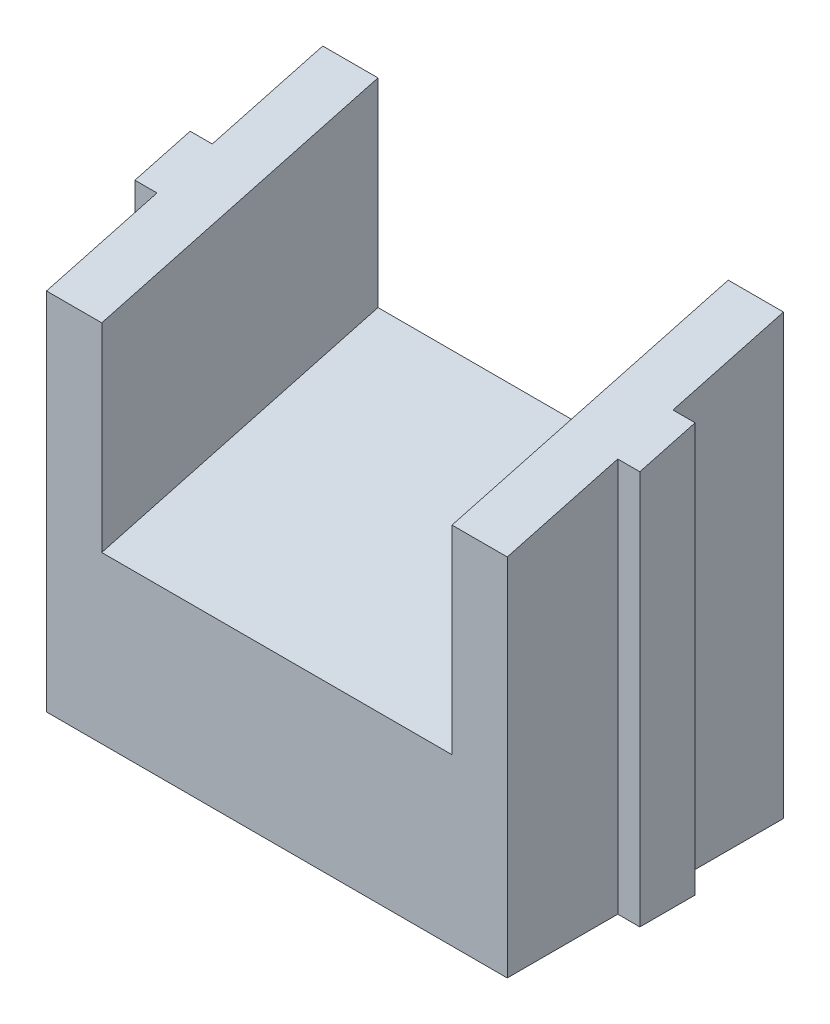
from build123d import *

# Parameters (mm, degrees)
SKETCH_1_W      = 2
SKETCH_1_H      = 5
SKETCH_1_W_2    = 41.7
SKETCH_1_H_2    = 25
EXTRUDE_1_DEPTH = 15
EXTRUDE_2_DEPTH = 41.7
SKETCH_4_W      = 5
SKETCH_4_H      = 25.88190451
EXTRUDE_4_DEPTH = 18
EXTRUDE_3_REACH = 58.078
SKETCH_3_W      = 2
SKETCH_3_H      = 5


with BuildPart() as part:
    # 草圖1 → 填料-伸長1 (new body)
    with BuildSketch(Plane(origin=(0, 0, 0), x_dir=(1, 0, 0), z_dir=(0, 1, 0))):
        with Locations((-1, 12.5)):
            Rectangle(SKETCH_1_W, SKETCH_1_H)
        with Locations((20.85, 12.5)):
            Rectangle(SKETCH_1_W_2, SKETCH_1_H_2)
        with Locations((42.7, 12.5)):
            Rectangle(SKETCH_1_W, SKETCH_1_H)
    extrude(amount=EXTRUDE_1_DEPTH)

    # 草圖2 → 填料-伸長2 (add)
    with BuildSketch(Plane(origin=(41.7, 0, 0), x_dir=(0, 0, -1), z_dir=(1, 0, 0))):
        Polygon((0, 15), (25, 21.698729811), (25, 15), align=None)
    extrude(amount=-EXTRUDE_2_DEPTH)

    # 草圖4 → 填料-伸長4 (add, along a direction that is not the sketch's normal)
    with BuildSketch(Plane(origin=(0, 13.995190528, 3.75), x_dir=(1, 0, 0), z_dir=(0, 0.9659258262890681, 0.25881904510252157))):
        with Locations((2.5, 16.823237932)):
            Rectangle(SKETCH_4_W, SKETCH_4_H)
        with Locations((39.2, 16.823237932)):
            Rectangle(SKETCH_4_W, SKETCH_4_H)
    extrude(amount=EXTRUDE_4_DEPTH, dir=(0, 1, 0))

    # 填料-伸長3: up to this plane
    extrude_3_end = Plane(origin=(0, 31.995190528, 3.75), z_dir=(0, 0.9659258262890682, 0.2588190451025215))
    # 草圖3 → 填料-伸長3 (add, up to the surface)
    with BuildSketch(Plane(origin=(0, 15, 0), x_dir=(1, 0, 0), z_dir=(0, 1, 0)), mode=Mode.PRIVATE) as extrude_3_sk1:
        with Locations((42.7, 12.5)):
            Rectangle(SKETCH_3_W, SKETCH_3_H)
    extrude_3_tool1 = split(extrude(extrude_3_sk1.sketch, amount=EXTRUDE_3_REACH, mode=Mode.PRIVATE), bisect_by=extrude_3_end, keep=Keep.BOTH, mode=Mode.PRIVATE)
    add(extrude_3_tool1.solids().sort_by_distance((42.7, 15, -12.5))[0])
    # 草圖3 → 填料-伸長3 (add, up to the surface)
    with BuildSketch(Plane(origin=(0, 15, 0), x_dir=(1, 0, 0), z_dir=(0, 1, 0)), mode=Mode.PRIVATE) as extrude_3_sk2:
        with Locations((-1, 12.5)):
            Rectangle(SKETCH_3_W, SKETCH_3_H)
    extrude_3_tool2 = split(extrude(extrude_3_sk2.sketch, amount=EXTRUDE_3_REACH, mode=Mode.PRIVATE), bisect_by=extrude_3_end, keep=Keep.BOTH, mode=Mode.PRIVATE)
    add(extrude_3_tool2.solids().sort_by_distance((-1, 15, -12.5))[0])


solid = part.part
